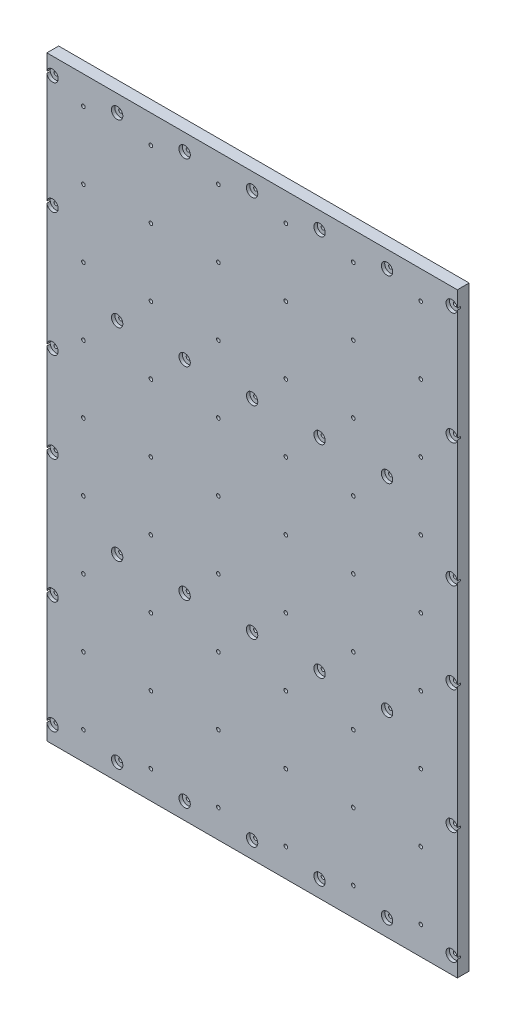
from build123d import *

# Parameters (mm, degrees)
SKIZZE1_W                       = 730
SKIZZE1_H                       = 1060
AUFSATZ_LINEAR_AUSTRAGEN1_DEPTH = 21
SKIZZE2_R                       = 3.25
SCHNITT_LINEAR_AUSTRAGEN1_DEPTH = 40
SKIZZE3_R                       = 10
SCHNITT_LINEAR_AUSTRAGEN2_DEPTH = 5
LINEARES_MUSTER1_COUNT          = 9
LINEARES_MUSTER1_PITCH          = 120
LINEARES_MUSTER1_COUNT_DIR2     = 3
LINEARES_MUSTER1_PITCH_DIR2     = 120
SPIEGELN1_COPY_1_SKETCH_R       = 3.25
SPIEGELN1_COPY_1_DEPTH          = 40
SPIEGELN1_COPY_2_SKETCH_R       = 3.25
SPIEGELN1_COPY_2_DEPTH          = 40
SPIEGELN1_COPY_3_SKETCH_R       = 3.25
SPIEGELN1_COPY_3_DEPTH          = 40
SPIEGELN1_COPY_4_SKETCH_R       = 3.25
SPIEGELN1_COPY_4_DEPTH          = 40
SPIEGELN1_COPY_5_SKETCH_R       = 3.25
SPIEGELN1_COPY_5_DEPTH          = 40
SPIEGELN1_COPY_6_SKETCH_R       = 3.25
SPIEGELN1_COPY_6_DEPTH          = 40
SPIEGELN1_COPY_7_SKETCH_R       = 3.25
SPIEGELN1_COPY_7_DEPTH          = 40
SPIEGELN1_COPY_8_SKETCH_R       = 3.25
SPIEGELN1_COPY_8_DEPTH          = 40
SPIEGELN1_COPY_9_SKETCH_R       = 3.25
SPIEGELN1_COPY_9_DEPTH          = 40
SPIEGELN1_COPY_10_SKETCH_R      = 3.25
SPIEGELN1_COPY_10_DEPTH         = 40
SPIEGELN1_COPY_11_SKETCH_R      = 3.25
SPIEGELN1_COPY_11_DEPTH         = 40
SPIEGELN1_COPY_12_SKETCH_R      = 3.25
SPIEGELN1_COPY_12_DEPTH         = 40
SPIEGELN1_COPY_13_SKETCH_R      = 3.25
SPIEGELN1_COPY_13_DEPTH         = 40
SPIEGELN1_COPY_14_SKETCH_R      = 3.25
SPIEGELN1_COPY_14_DEPTH         = 40
SPIEGELN1_COPY_15_SKETCH_R      = 3.25
SPIEGELN1_COPY_15_DEPTH         = 40
SPIEGELN1_COPY_16_SKETCH_R      = 3.25
SPIEGELN1_COPY_16_DEPTH         = 40
SPIEGELN1_COPY_17_SKETCH_R      = 3.25
SPIEGELN1_COPY_17_DEPTH         = 40
SPIEGELN1_COPY_18_SKETCH_R      = 3.25
SPIEGELN1_COPY_18_DEPTH         = 40
SPIEGELN1_COPY_19_SKETCH_R      = 3.25
SPIEGELN1_COPY_19_DEPTH         = 40
SPIEGELN1_COPY_20_SKETCH_R      = 3.25
SPIEGELN1_COPY_20_DEPTH         = 40
SPIEGELN1_COPY_21_SKETCH_R      = 3.25
SPIEGELN1_COPY_21_DEPTH         = 40
SPIEGELN1_COPY_22_SKETCH_R      = 3.25
SPIEGELN1_COPY_22_DEPTH         = 40
SPIEGELN1_COPY_23_SKETCH_R      = 3.25
SPIEGELN1_COPY_23_DEPTH         = 40
SPIEGELN1_COPY_24_SKETCH_R      = 3.25
SPIEGELN1_COPY_24_DEPTH         = 40
SPIEGELN1_COPY_25_SKETCH_R      = 3.25
SPIEGELN1_COPY_25_DEPTH         = 40
SPIEGELN1_COPY_26_SKETCH_R      = 3.25
SPIEGELN1_COPY_26_DEPTH         = 40
SPIEGELN1_COPY_27_SKETCH_R      = 10
SPIEGELN1_COPY_27_DEPTH         = 5
SPIEGELN1_COPY_28_SKETCH_R      = 10
SPIEGELN1_COPY_28_DEPTH         = 5
SPIEGELN1_COPY_29_SKETCH_R      = 10
SPIEGELN1_COPY_29_DEPTH         = 5
SPIEGELN1_COPY_30_SKETCH_R      = 10
SPIEGELN1_COPY_30_DEPTH         = 5
SPIEGELN1_COPY_31_SKETCH_R      = 10
SPIEGELN1_COPY_31_DEPTH         = 5
SPIEGELN1_COPY_32_SKETCH_R      = 10
SPIEGELN1_COPY_32_DEPTH         = 5
SPIEGELN1_COPY_33_SKETCH_R      = 10
SPIEGELN1_COPY_33_DEPTH         = 5
SPIEGELN1_COPY_34_SKETCH_R      = 10
SPIEGELN1_COPY_34_DEPTH         = 5
SPIEGELN1_COPY_35_SKETCH_R      = 10
SPIEGELN1_COPY_35_DEPTH         = 5
SPIEGELN1_COPY_36_SKETCH_R      = 10
SPIEGELN1_COPY_36_DEPTH         = 5
SPIEGELN1_COPY_37_SKETCH_R      = 10
SPIEGELN1_COPY_37_DEPTH         = 5
SPIEGELN1_COPY_38_SKETCH_R      = 10
SPIEGELN1_COPY_38_DEPTH         = 5
SPIEGELN1_COPY_39_SKETCH_R      = 10
SPIEGELN1_COPY_39_DEPTH         = 5
SPIEGELN1_COPY_40_SKETCH_R      = 10
SPIEGELN1_COPY_40_DEPTH         = 5
SPIEGELN1_COPY_41_SKETCH_R      = 10
SPIEGELN1_COPY_41_DEPTH         = 5
SPIEGELN1_COPY_42_SKETCH_R      = 10
SPIEGELN1_COPY_42_DEPTH         = 5
SPIEGELN1_COPY_43_SKETCH_R      = 10
SPIEGELN1_COPY_43_DEPTH         = 5
SPIEGELN1_COPY_44_SKETCH_R      = 10
SPIEGELN1_COPY_44_DEPTH         = 5
SPIEGELN1_COPY_45_SKETCH_R      = 10
SPIEGELN1_COPY_45_DEPTH         = 5
SPIEGELN1_COPY_46_SKETCH_R      = 10
SPIEGELN1_COPY_46_DEPTH         = 5
SPIEGELN1_COPY_47_SKETCH_R      = 10
SPIEGELN1_COPY_47_DEPTH         = 5
SPIEGELN1_COPY_48_SKETCH_R      = 10
SPIEGELN1_COPY_48_DEPTH         = 5
SPIEGELN1_COPY_49_SKETCH_R      = 10
SPIEGELN1_COPY_49_DEPTH         = 5
SPIEGELN1_COPY_50_SKETCH_R      = 10
SPIEGELN1_COPY_50_DEPTH         = 5
SPIEGELN1_COPY_51_SKETCH_R      = 10
SPIEGELN1_COPY_51_DEPTH         = 5
SPIEGELN1_COPY_52_SKETCH_R      = 10
SPIEGELN1_COPY_52_DEPTH         = 5
SKIZZE4_R                       = 3.25
SCHNITT_LINEAR_AUSTRAGEN3_DEPTH = 50
SKIZZE5_R                       = 10.1
SCHNITT_LINEAR_AUSTRAGEN6_DEPTH = 6


with BuildPart() as part:
    # Skizze1 → Aufsatz-Linear austragen1 (new body)
    with BuildSketch(Plane.XY):
        Rectangle(SKIZZE1_W, SKIZZE1_H)
    extrude(amount=AUFSATZ_LINEAR_AUSTRAGEN1_DEPTH)

    # Skizze2 → Schnitt-Linear austragen1 (cut)
    with BuildSketch(Plane(origin=(0, 0, 0), x_dir=(-1, 0, 0), z_dir=(0, 0, -1))):
        with Locations((60, -480)):
            Circle(SKIZZE2_R)
    schnitt_linear_austragen1 = extrude(amount=-SCHNITT_LINEAR_AUSTRAGEN1_DEPTH, mode=Mode.SUBTRACT)

    # Skizze3 → Schnitt-Linear austragen2 (cut)
    with BuildSketch(Plane(origin=(0, 0, 0), x_dir=(-1, 0, 0), z_dir=(0, 0, -1))):
        with Locations((60, -480)):
            Circle(SKIZZE3_R)
    schnitt_linear_austragen2 = extrude(amount=-SCHNITT_LINEAR_AUSTRAGEN2_DEPTH, mode=Mode.SUBTRACT)

    # Lineares Muster1: Schnitt-Linear austragen1, Schnitt-Linear austragen2 9 × 3
    with Locations(*[(-j * LINEARES_MUSTER1_PITCH_DIR2, i * LINEARES_MUSTER1_PITCH, 0) for i in range(LINEARES_MUSTER1_COUNT) for j in range(LINEARES_MUSTER1_COUNT_DIR2) if (i, j) != (0, 0)]):
        add(schnitt_linear_austragen1, mode=Mode.SUBTRACT)
        add(schnitt_linear_austragen2, mode=Mode.SUBTRACT)

    # Spiegeln1: Schnitt-Linear austragen1, Schnitt-Linear austragen2 across plane
    add(schnitt_linear_austragen1.mirror(Plane(origin=(0, 0, 0), x_dir=(0, 0, 1), z_dir=(1, 0, 0))), mode=Mode.SUBTRACT)
    add(schnitt_linear_austragen2.mirror(Plane(origin=(0, 0, 0), x_dir=(0, 0, 1), z_dir=(1, 0, 0))), mode=Mode.SUBTRACT)

    # Spiegeln1 copy 1 sketch → Spiegeln1 copy 1 (cut)
    with BuildSketch(Plane(origin=(120, 0, 0), x_dir=(1, 0, 0), z_dir=(0, 0, -1))):
        with Locations((60, 480)):
            Circle(SPIEGELN1_COPY_1_SKETCH_R)
    extrude(amount=-SPIEGELN1_COPY_1_DEPTH, mode=Mode.SUBTRACT)

    # Spiegeln1 copy 2 sketch → Spiegeln1 copy 2 (cut)
    with BuildSketch(Plane(origin=(240, 0, 0), x_dir=(1, 0, 0), z_dir=(0, 0, -1))):
        with Locations((60, 480)):
            Circle(SPIEGELN1_COPY_2_SKETCH_R)
    extrude(amount=-SPIEGELN1_COPY_2_DEPTH, mode=Mode.SUBTRACT)

    # Spiegeln1 copy 3 sketch → Spiegeln1 copy 3 (cut)
    with BuildSketch(Plane(origin=(0, 120, 0), x_dir=(1, 0, 0), z_dir=(0, 0, -1))):
        with Locations((60, 480)):
            Circle(SPIEGELN1_COPY_3_SKETCH_R)
    extrude(amount=-SPIEGELN1_COPY_3_DEPTH, mode=Mode.SUBTRACT)

    # Spiegeln1 copy 4 sketch → Spiegeln1 copy 4 (cut)
    with BuildSketch(Plane(origin=(120, 120, 0), x_dir=(1, 0, 0), z_dir=(0, 0, -1))):
        with Locations((60, 480)):
            Circle(SPIEGELN1_COPY_4_SKETCH_R)
    extrude(amount=-SPIEGELN1_COPY_4_DEPTH, mode=Mode.SUBTRACT)

    # Spiegeln1 copy 5 sketch → Spiegeln1 copy 5 (cut)
    with BuildSketch(Plane(origin=(240, 120, 0), x_dir=(1, 0, 0), z_dir=(0, 0, -1))):
        with Locations((60, 480)):
            Circle(SPIEGELN1_COPY_5_SKETCH_R)
    extrude(amount=-SPIEGELN1_COPY_5_DEPTH, mode=Mode.SUBTRACT)

    # Spiegeln1 copy 6 sketch → Spiegeln1 copy 6 (cut)
    with BuildSketch(Plane(origin=(0, 240, 0), x_dir=(1, 0, 0), z_dir=(0, 0, -1))):
        with Locations((60, 480)):
            Circle(SPIEGELN1_COPY_6_SKETCH_R)
    extrude(amount=-SPIEGELN1_COPY_6_DEPTH, mode=Mode.SUBTRACT)

    # Spiegeln1 copy 7 sketch → Spiegeln1 copy 7 (cut)
    with BuildSketch(Plane(origin=(120, 240, 0), x_dir=(1, 0, 0), z_dir=(0, 0, -1))):
        with Locations((60, 480)):
            Circle(SPIEGELN1_COPY_7_SKETCH_R)
    extrude(amount=-SPIEGELN1_COPY_7_DEPTH, mode=Mode.SUBTRACT)

    # Spiegeln1 copy 8 sketch → Spiegeln1 copy 8 (cut)
    with BuildSketch(Plane(origin=(240, 240, 0), x_dir=(1, 0, 0), z_dir=(0, 0, -1))):
        with Locations((60, 480)):
            Circle(SPIEGELN1_COPY_8_SKETCH_R)
    extrude(amount=-SPIEGELN1_COPY_8_DEPTH, mode=Mode.SUBTRACT)

    # Spiegeln1 copy 9 sketch → Spiegeln1 copy 9 (cut)
    with BuildSketch(Plane(origin=(0, 360, 0), x_dir=(1, 0, 0), z_dir=(0, 0, -1))):
        with Locations((60, 480)):
            Circle(SPIEGELN1_COPY_9_SKETCH_R)
    extrude(amount=-SPIEGELN1_COPY_9_DEPTH, mode=Mode.SUBTRACT)

    # Spiegeln1 copy 10 sketch → Spiegeln1 copy 10 (cut)
    with BuildSketch(Plane(origin=(120, 360, 0), x_dir=(1, 0, 0), z_dir=(0, 0, -1))):
        with Locations((60, 480)):
            Circle(SPIEGELN1_COPY_10_SKETCH_R)
    extrude(amount=-SPIEGELN1_COPY_10_DEPTH, mode=Mode.SUBTRACT)

    # Spiegeln1 copy 11 sketch → Spiegeln1 copy 11 (cut)
    with BuildSketch(Plane(origin=(240, 360, 0), x_dir=(1, 0, 0), z_dir=(0, 0, -1))):
        with Locations((60, 480)):
            Circle(SPIEGELN1_COPY_11_SKETCH_R)
    extrude(amount=-SPIEGELN1_COPY_11_DEPTH, mode=Mode.SUBTRACT)

    # Spiegeln1 copy 12 sketch → Spiegeln1 copy 12 (cut)
    with BuildSketch(Plane(origin=(0, 480, 0), x_dir=(1, 0, 0), z_dir=(0, 0, -1))):
        with Locations((60, 480)):
            Circle(SPIEGELN1_COPY_12_SKETCH_R)
    extrude(amount=-SPIEGELN1_COPY_12_DEPTH, mode=Mode.SUBTRACT)

    # Spiegeln1 copy 13 sketch → Spiegeln1 copy 13 (cut)
    with BuildSketch(Plane(origin=(120, 480, 0), x_dir=(1, 0, 0), z_dir=(0, 0, -1))):
        with Locations((60, 480)):
            Circle(SPIEGELN1_COPY_13_SKETCH_R)
    extrude(amount=-SPIEGELN1_COPY_13_DEPTH, mode=Mode.SUBTRACT)

    # Spiegeln1 copy 14 sketch → Spiegeln1 copy 14 (cut)
    with BuildSketch(Plane(origin=(240, 480, 0), x_dir=(1, 0, 0), z_dir=(0, 0, -1))):
        with Locations((60, 480)):
            Circle(SPIEGELN1_COPY_14_SKETCH_R)
    extrude(amount=-SPIEGELN1_COPY_14_DEPTH, mode=Mode.SUBTRACT)

    # Spiegeln1 copy 15 sketch → Spiegeln1 copy 15 (cut)
    with BuildSketch(Plane(origin=(0, 600, 0), x_dir=(1, 0, 0), z_dir=(0, 0, -1))):
        with Locations((60, 480)):
            Circle(SPIEGELN1_COPY_15_SKETCH_R)
    extrude(amount=-SPIEGELN1_COPY_15_DEPTH, mode=Mode.SUBTRACT)

    # Spiegeln1 copy 16 sketch → Spiegeln1 copy 16 (cut)
    with BuildSketch(Plane(origin=(120, 600, 0), x_dir=(1, 0, 0), z_dir=(0, 0, -1))):
        with Locations((60, 480)):
            Circle(SPIEGELN1_COPY_16_SKETCH_R)
    extrude(amount=-SPIEGELN1_COPY_16_DEPTH, mode=Mode.SUBTRACT)

    # Spiegeln1 copy 17 sketch → Spiegeln1 copy 17 (cut)
    with BuildSketch(Plane(origin=(240, 600, 0), x_dir=(1, 0, 0), z_dir=(0, 0, -1))):
        with Locations((60, 480)):
            Circle(SPIEGELN1_COPY_17_SKETCH_R)
    extrude(amount=-SPIEGELN1_COPY_17_DEPTH, mode=Mode.SUBTRACT)

    # Spiegeln1 copy 18 sketch → Spiegeln1 copy 18 (cut)
    with BuildSketch(Plane(origin=(0, 720, 0), x_dir=(1, 0, 0), z_dir=(0, 0, -1))):
        with Locations((60, 480)):
            Circle(SPIEGELN1_COPY_18_SKETCH_R)
    extrude(amount=-SPIEGELN1_COPY_18_DEPTH, mode=Mode.SUBTRACT)

    # Spiegeln1 copy 19 sketch → Spiegeln1 copy 19 (cut)
    with BuildSketch(Plane(origin=(120, 720, 0), x_dir=(1, 0, 0), z_dir=(0, 0, -1))):
        with Locations((60, 480)):
            Circle(SPIEGELN1_COPY_19_SKETCH_R)
    extrude(amount=-SPIEGELN1_COPY_19_DEPTH, mode=Mode.SUBTRACT)

    # Spiegeln1 copy 20 sketch → Spiegeln1 copy 20 (cut)
    with BuildSketch(Plane(origin=(240, 720, 0), x_dir=(1, 0, 0), z_dir=(0, 0, -1))):
        with Locations((60, 480)):
            Circle(SPIEGELN1_COPY_20_SKETCH_R)
    extrude(amount=-SPIEGELN1_COPY_20_DEPTH, mode=Mode.SUBTRACT)

    # Spiegeln1 copy 21 sketch → Spiegeln1 copy 21 (cut)
    with BuildSketch(Plane(origin=(0, 840, 0), x_dir=(1, 0, 0), z_dir=(0, 0, -1))):
        with Locations((60, 480)):
            Circle(SPIEGELN1_COPY_21_SKETCH_R)
    extrude(amount=-SPIEGELN1_COPY_21_DEPTH, mode=Mode.SUBTRACT)

    # Spiegeln1 copy 22 sketch → Spiegeln1 copy 22 (cut)
    with BuildSketch(Plane(origin=(120, 840, 0), x_dir=(1, 0, 0), z_dir=(0, 0, -1))):
        with Locations((60, 480)):
            Circle(SPIEGELN1_COPY_22_SKETCH_R)
    extrude(amount=-SPIEGELN1_COPY_22_DEPTH, mode=Mode.SUBTRACT)

    # Spiegeln1 copy 23 sketch → Spiegeln1 copy 23 (cut)
    with BuildSketch(Plane(origin=(240, 840, 0), x_dir=(1, 0, 0), z_dir=(0, 0, -1))):
        with Locations((60, 480)):
            Circle(SPIEGELN1_COPY_23_SKETCH_R)
    extrude(amount=-SPIEGELN1_COPY_23_DEPTH, mode=Mode.SUBTRACT)

    # Spiegeln1 copy 24 sketch → Spiegeln1 copy 24 (cut)
    with BuildSketch(Plane(origin=(0, 960, 0), x_dir=(1, 0, 0), z_dir=(0, 0, -1))):
        with Locations((60, 480)):
            Circle(SPIEGELN1_COPY_24_SKETCH_R)
    extrude(amount=-SPIEGELN1_COPY_24_DEPTH, mode=Mode.SUBTRACT)

    # Spiegeln1 copy 25 sketch → Spiegeln1 copy 25 (cut)
    with BuildSketch(Plane(origin=(120, 960, 0), x_dir=(1, 0, 0), z_dir=(0, 0, -1))):
        with Locations((60, 480)):
            Circle(SPIEGELN1_COPY_25_SKETCH_R)
    extrude(amount=-SPIEGELN1_COPY_25_DEPTH, mode=Mode.SUBTRACT)

    # Spiegeln1 copy 26 sketch → Spiegeln1 copy 26 (cut)
    with BuildSketch(Plane(origin=(240, 960, 0), x_dir=(1, 0, 0), z_dir=(0, 0, -1))):
        with Locations((60, 480)):
            Circle(SPIEGELN1_COPY_26_SKETCH_R)
    extrude(amount=-SPIEGELN1_COPY_26_DEPTH, mode=Mode.SUBTRACT)

    # Spiegeln1 copy 27 sketch → Spiegeln1 copy 27 (cut)
    with BuildSketch(Plane(origin=(120, 0, 0), x_dir=(1, 0, 0), z_dir=(0, 0, -1))):
        with Locations((60, 480)):
            Circle(SPIEGELN1_COPY_27_SKETCH_R)
    extrude(amount=-SPIEGELN1_COPY_27_DEPTH, mode=Mode.SUBTRACT)

    # Spiegeln1 copy 28 sketch → Spiegeln1 copy 28 (cut)
    with BuildSketch(Plane(origin=(240, 0, 0), x_dir=(1, 0, 0), z_dir=(0, 0, -1))):
        with Locations((60, 480)):
            Circle(SPIEGELN1_COPY_28_SKETCH_R)
    extrude(amount=-SPIEGELN1_COPY_28_DEPTH, mode=Mode.SUBTRACT)

    # Spiegeln1 copy 29 sketch → Spiegeln1 copy 29 (cut)
    with BuildSketch(Plane(origin=(0, 120, 0), x_dir=(1, 0, 0), z_dir=(0, 0, -1))):
        with Locations((60, 480)):
            Circle(SPIEGELN1_COPY_29_SKETCH_R)
    extrude(amount=-SPIEGELN1_COPY_29_DEPTH, mode=Mode.SUBTRACT)

    # Spiegeln1 copy 30 sketch → Spiegeln1 copy 30 (cut)
    with BuildSketch(Plane(origin=(120, 120, 0), x_dir=(1, 0, 0), z_dir=(0, 0, -1))):
        with Locations((60, 480)):
            Circle(SPIEGELN1_COPY_30_SKETCH_R)
    extrude(amount=-SPIEGELN1_COPY_30_DEPTH, mode=Mode.SUBTRACT)

    # Spiegeln1 copy 31 sketch → Spiegeln1 copy 31 (cut)
    with BuildSketch(Plane(origin=(240, 120, 0), x_dir=(1, 0, 0), z_dir=(0, 0, -1))):
        with Locations((60, 480)):
            Circle(SPIEGELN1_COPY_31_SKETCH_R)
    extrude(amount=-SPIEGELN1_COPY_31_DEPTH, mode=Mode.SUBTRACT)

    # Spiegeln1 copy 32 sketch → Spiegeln1 copy 32 (cut)
    with BuildSketch(Plane(origin=(0, 240, 0), x_dir=(1, 0, 0), z_dir=(0, 0, -1))):
        with Locations((60, 480)):
            Circle(SPIEGELN1_COPY_32_SKETCH_R)
    extrude(amount=-SPIEGELN1_COPY_32_DEPTH, mode=Mode.SUBTRACT)

    # Spiegeln1 copy 33 sketch → Spiegeln1 copy 33 (cut)
    with BuildSketch(Plane(origin=(120, 240, 0), x_dir=(1, 0, 0), z_dir=(0, 0, -1))):
        with Locations((60, 480)):
            Circle(SPIEGELN1_COPY_33_SKETCH_R)
    extrude(amount=-SPIEGELN1_COPY_33_DEPTH, mode=Mode.SUBTRACT)

    # Spiegeln1 copy 34 sketch → Spiegeln1 copy 34 (cut)
    with BuildSketch(Plane(origin=(240, 240, 0), x_dir=(1, 0, 0), z_dir=(0, 0, -1))):
        with Locations((60, 480)):
            Circle(SPIEGELN1_COPY_34_SKETCH_R)
    extrude(amount=-SPIEGELN1_COPY_34_DEPTH, mode=Mode.SUBTRACT)

    # Spiegeln1 copy 35 sketch → Spiegeln1 copy 35 (cut)
    with BuildSketch(Plane(origin=(0, 360, 0), x_dir=(1, 0, 0), z_dir=(0, 0, -1))):
        with Locations((60, 480)):
            Circle(SPIEGELN1_COPY_35_SKETCH_R)
    extrude(amount=-SPIEGELN1_COPY_35_DEPTH, mode=Mode.SUBTRACT)

    # Spiegeln1 copy 36 sketch → Spiegeln1 copy 36 (cut)
    with BuildSketch(Plane(origin=(120, 360, 0), x_dir=(1, 0, 0), z_dir=(0, 0, -1))):
        with Locations((60, 480)):
            Circle(SPIEGELN1_COPY_36_SKETCH_R)
    extrude(amount=-SPIEGELN1_COPY_36_DEPTH, mode=Mode.SUBTRACT)

    # Spiegeln1 copy 37 sketch → Spiegeln1 copy 37 (cut)
    with BuildSketch(Plane(origin=(240, 360, 0), x_dir=(1, 0, 0), z_dir=(0, 0, -1))):
        with Locations((60, 480)):
            Circle(SPIEGELN1_COPY_37_SKETCH_R)
    extrude(amount=-SPIEGELN1_COPY_37_DEPTH, mode=Mode.SUBTRACT)

    # Spiegeln1 copy 38 sketch → Spiegeln1 copy 38 (cut)
    with BuildSketch(Plane(origin=(0, 480, 0), x_dir=(1, 0, 0), z_dir=(0, 0, -1))):
        with Locations((60, 480)):
            Circle(SPIEGELN1_COPY_38_SKETCH_R)
    extrude(amount=-SPIEGELN1_COPY_38_DEPTH, mode=Mode.SUBTRACT)

    # Spiegeln1 copy 39 sketch → Spiegeln1 copy 39 (cut)
    with BuildSketch(Plane(origin=(120, 480, 0), x_dir=(1, 0, 0), z_dir=(0, 0, -1))):
        with Locations((60, 480)):
            Circle(SPIEGELN1_COPY_39_SKETCH_R)
    extrude(amount=-SPIEGELN1_COPY_39_DEPTH, mode=Mode.SUBTRACT)

    # Spiegeln1 copy 40 sketch → Spiegeln1 copy 40 (cut)
    with BuildSketch(Plane(origin=(240, 480, 0), x_dir=(1, 0, 0), z_dir=(0, 0, -1))):
        with Locations((60, 480)):
            Circle(SPIEGELN1_COPY_40_SKETCH_R)
    extrude(amount=-SPIEGELN1_COPY_40_DEPTH, mode=Mode.SUBTRACT)

    # Spiegeln1 copy 41 sketch → Spiegeln1 copy 41 (cut)
    with BuildSketch(Plane(origin=(0, 600, 0), x_dir=(1, 0, 0), z_dir=(0, 0, -1))):
        with Locations((60, 480)):
            Circle(SPIEGELN1_COPY_41_SKETCH_R)
    extrude(amount=-SPIEGELN1_COPY_41_DEPTH, mode=Mode.SUBTRACT)

    # Spiegeln1 copy 42 sketch → Spiegeln1 copy 42 (cut)
    with BuildSketch(Plane(origin=(120, 600, 0), x_dir=(1, 0, 0), z_dir=(0, 0, -1))):
        with Locations((60, 480)):
            Circle(SPIEGELN1_COPY_42_SKETCH_R)
    extrude(amount=-SPIEGELN1_COPY_42_DEPTH, mode=Mode.SUBTRACT)

    # Spiegeln1 copy 43 sketch → Spiegeln1 copy 43 (cut)
    with BuildSketch(Plane(origin=(240, 600, 0), x_dir=(1, 0, 0), z_dir=(0, 0, -1))):
        with Locations((60, 480)):
            Circle(SPIEGELN1_COPY_43_SKETCH_R)
    extrude(amount=-SPIEGELN1_COPY_43_DEPTH, mode=Mode.SUBTRACT)

    # Spiegeln1 copy 44 sketch → Spiegeln1 copy 44 (cut)
    with BuildSketch(Plane(origin=(0, 720, 0), x_dir=(1, 0, 0), z_dir=(0, 0, -1))):
        with Locations((60, 480)):
            Circle(SPIEGELN1_COPY_44_SKETCH_R)
    extrude(amount=-SPIEGELN1_COPY_44_DEPTH, mode=Mode.SUBTRACT)

    # Spiegeln1 copy 45 sketch → Spiegeln1 copy 45 (cut)
    with BuildSketch(Plane(origin=(120, 720, 0), x_dir=(1, 0, 0), z_dir=(0, 0, -1))):
        with Locations((60, 480)):
            Circle(SPIEGELN1_COPY_45_SKETCH_R)
    extrude(amount=-SPIEGELN1_COPY_45_DEPTH, mode=Mode.SUBTRACT)

    # Spiegeln1 copy 46 sketch → Spiegeln1 copy 46 (cut)
    with BuildSketch(Plane(origin=(240, 720, 0), x_dir=(1, 0, 0), z_dir=(0, 0, -1))):
        with Locations((60, 480)):
            Circle(SPIEGELN1_COPY_46_SKETCH_R)
    extrude(amount=-SPIEGELN1_COPY_46_DEPTH, mode=Mode.SUBTRACT)

    # Spiegeln1 copy 47 sketch → Spiegeln1 copy 47 (cut)
    with BuildSketch(Plane(origin=(0, 840, 0), x_dir=(1, 0, 0), z_dir=(0, 0, -1))):
        with Locations((60, 480)):
            Circle(SPIEGELN1_COPY_47_SKETCH_R)
    extrude(amount=-SPIEGELN1_COPY_47_DEPTH, mode=Mode.SUBTRACT)

    # Spiegeln1 copy 48 sketch → Spiegeln1 copy 48 (cut)
    with BuildSketch(Plane(origin=(120, 840, 0), x_dir=(1, 0, 0), z_dir=(0, 0, -1))):
        with Locations((60, 480)):
            Circle(SPIEGELN1_COPY_48_SKETCH_R)
    extrude(amount=-SPIEGELN1_COPY_48_DEPTH, mode=Mode.SUBTRACT)

    # Spiegeln1 copy 49 sketch → Spiegeln1 copy 49 (cut)
    with BuildSketch(Plane(origin=(240, 840, 0), x_dir=(1, 0, 0), z_dir=(0, 0, -1))):
        with Locations((60, 480)):
            Circle(SPIEGELN1_COPY_49_SKETCH_R)
    extrude(amount=-SPIEGELN1_COPY_49_DEPTH, mode=Mode.SUBTRACT)

    # Spiegeln1 copy 50 sketch → Spiegeln1 copy 50 (cut)
    with BuildSketch(Plane(origin=(0, 960, 0), x_dir=(1, 0, 0), z_dir=(0, 0, -1))):
        with Locations((60, 480)):
            Circle(SPIEGELN1_COPY_50_SKETCH_R)
    extrude(amount=-SPIEGELN1_COPY_50_DEPTH, mode=Mode.SUBTRACT)

    # Spiegeln1 copy 51 sketch → Spiegeln1 copy 51 (cut)
    with BuildSketch(Plane(origin=(120, 960, 0), x_dir=(1, 0, 0), z_dir=(0, 0, -1))):
        with Locations((60, 480)):
            Circle(SPIEGELN1_COPY_51_SKETCH_R)
    extrude(amount=-SPIEGELN1_COPY_51_DEPTH, mode=Mode.SUBTRACT)

    # Spiegeln1 copy 52 sketch → Spiegeln1 copy 52 (cut)
    with BuildSketch(Plane(origin=(240, 960, 0), x_dir=(1, 0, 0), z_dir=(0, 0, -1))):
        with Locations((60, 480)):
            Circle(SPIEGELN1_COPY_52_SKETCH_R)
    extrude(amount=-SPIEGELN1_COPY_52_DEPTH, mode=Mode.SUBTRACT)

    # Skizze4 → Schnitt-Linear austragen3 (cut)
    with BuildSketch(Plane.XY.offset(21)):
        with Locations((0, -500)):
            Circle(SKIZZE4_R)
        with Locations((120, -500)):
            Circle(SKIZZE4_R)
        with Locations((240, -500)):
            Circle(SKIZZE4_R)
        with Locations(Location((-120, -500, 0), (0, 0, 180))):
            Circle(SKIZZE4_R)
        with Locations(Location((-240, -500, 0), (0, 0, 180))):
            Circle(SKIZZE4_R)
        with Locations((355, -500)):
            Circle(SKIZZE4_R)
        with Locations((355, -300)):
            Circle(SKIZZE4_R)
        with Locations((355, -80)):
            Circle(SKIZZE4_R)
        with Locations(Location((-355, -80, 0), (0, 0, 180))):
            Circle(SKIZZE4_R)
        with Locations(Location((-355, -300, 0), (0, 0, 180))):
            Circle(SKIZZE4_R)
        with Locations(Location((-355, -500, 0), (0, 0, 180))):
            Circle(SKIZZE4_R)
        with Locations(Location((355, 80, 0), (0, 0, 180))):
            Circle(SKIZZE4_R)
        with Locations(Location((355, 300, 0), (0, 0, 180))):
            Circle(SKIZZE4_R)
        with Locations(Location((355, 500, 0), (0, 0, 180))):
            Circle(SKIZZE4_R)
        with Locations(Location((240, 500, 0), (0, 0, 180))):
            Circle(SKIZZE4_R)
        with Locations(Location((120, 500, 0), (0, 0, 180))):
            Circle(SKIZZE4_R)
        with Locations(Location((0, 500, 0), (0, 0, 180))):
            Circle(SKIZZE4_R)
        with Locations((-355, 500)):
            Circle(SKIZZE4_R)
        with Locations((-355, 300)):
            Circle(SKIZZE4_R)
        with Locations((-355, 80)):
            Circle(SKIZZE4_R)
        with Locations((-240, 500)):
            Circle(SKIZZE4_R)
        with Locations((-120, 500)):
            Circle(SKIZZE4_R)
        with Locations((120, -180)):
            Circle(SKIZZE4_R)
        with Locations((240, -180)):
            Circle(SKIZZE4_R)
        with Locations((0, -180)):
            Circle(SKIZZE4_R)
        with Locations(Location((-120, -180, 0), (0, 0, 180))):
            Circle(SKIZZE4_R)
        with Locations(Location((-240, -180, 0), (0, 0, 180))):
            Circle(SKIZZE4_R)
        with Locations(Location((240, 180, 0), (0, 0, 180))):
            Circle(SKIZZE4_R)
        with Locations(Location((120, 180, 0), (0, 0, 180))):
            Circle(SKIZZE4_R)
        with Locations(Location((0, 180, 0), (0, 0, 180))):
            Circle(SKIZZE4_R)
        with Locations((-120, 180)):
            Circle(SKIZZE4_R)
        with Locations((-240, 180)):
            Circle(SKIZZE4_R)
    extrude(amount=-SCHNITT_LINEAR_AUSTRAGEN3_DEPTH, mode=Mode.SUBTRACT)

    # Skizze5 → Schnitt-Linear austragen6 (cut)
    with BuildSketch(Plane.XY.offset(21)):
        with Locations((355, -500)):
            Circle(SKIZZE5_R)
        with Locations((240, -500)):
            Circle(SKIZZE5_R)
        with Locations((120, -500)):
            Circle(SKIZZE5_R)
        with Locations((0, -500)):
            Circle(SKIZZE5_R)
        with Locations((-355, -500)):
            Circle(SKIZZE5_R)
        with Locations(Location((-240, -500, 0), (0, 0, 180))):
            Circle(SKIZZE5_R)
        with Locations(Location((-120, -500, 0), (0, 0, 180))):
            Circle(SKIZZE5_R)
        with Locations((240, -180)):
            Circle(SKIZZE5_R)
        with Locations((120, -180)):
            Circle(SKIZZE5_R)
        with Locations((0, -180)):
            Circle(SKIZZE5_R)
        with Locations((355, -300)):
            Circle(SKIZZE5_R)
        with Locations((355, -80)):
            Circle(SKIZZE5_R)
        with Locations((-355, -300)):
            Circle(SKIZZE5_R)
        with Locations((-355, -80)):
            Circle(SKIZZE5_R)
        with Locations(Location((-240, -180, 0), (0, 0, 180))):
            Circle(SKIZZE5_R)
        with Locations(Location((-120, -180, 0), (0, 0, 180))):
            Circle(SKIZZE5_R)
        with Locations((-120, 180)):
            Circle(SKIZZE5_R)
        with Locations((-240, 180)):
            Circle(SKIZZE5_R)
        with Locations((-355, 80)):
            Circle(SKIZZE5_R)
        with Locations((-355, 300)):
            Circle(SKIZZE5_R)
        with Locations((355, 80)):
            Circle(SKIZZE5_R)
        with Locations((355, 300)):
            Circle(SKIZZE5_R)
        with Locations(Location((0, 180, 0), (0, 0, 180))):
            Circle(SKIZZE5_R)
        with Locations(Location((120, 180, 0), (0, 0, 180))):
            Circle(SKIZZE5_R)
        with Locations(Location((240, 180, 0), (0, 0, 180))):
            Circle(SKIZZE5_R)
        with Locations((-120, 500)):
            Circle(SKIZZE5_R)
        with Locations((-240, 500)):
            Circle(SKIZZE5_R)
        with Locations((-355, 500)):
            Circle(SKIZZE5_R)
        with Locations(Location((0, 500, 0), (0, 0, 180))):
            Circle(SKIZZE5_R)
        with Locations(Location((120, 500, 0), (0, 0, 180))):
            Circle(SKIZZE5_R)
        with Locations(Location((240, 500, 0), (0, 0, 180))):
            Circle(SKIZZE5_R)
        with Locations((355, 500)):
            Circle(SKIZZE5_R)
    extrude(amount=-SCHNITT_LINEAR_AUSTRAGEN6_DEPTH, mode=Mode.SUBTRACT)


solid = part.part
